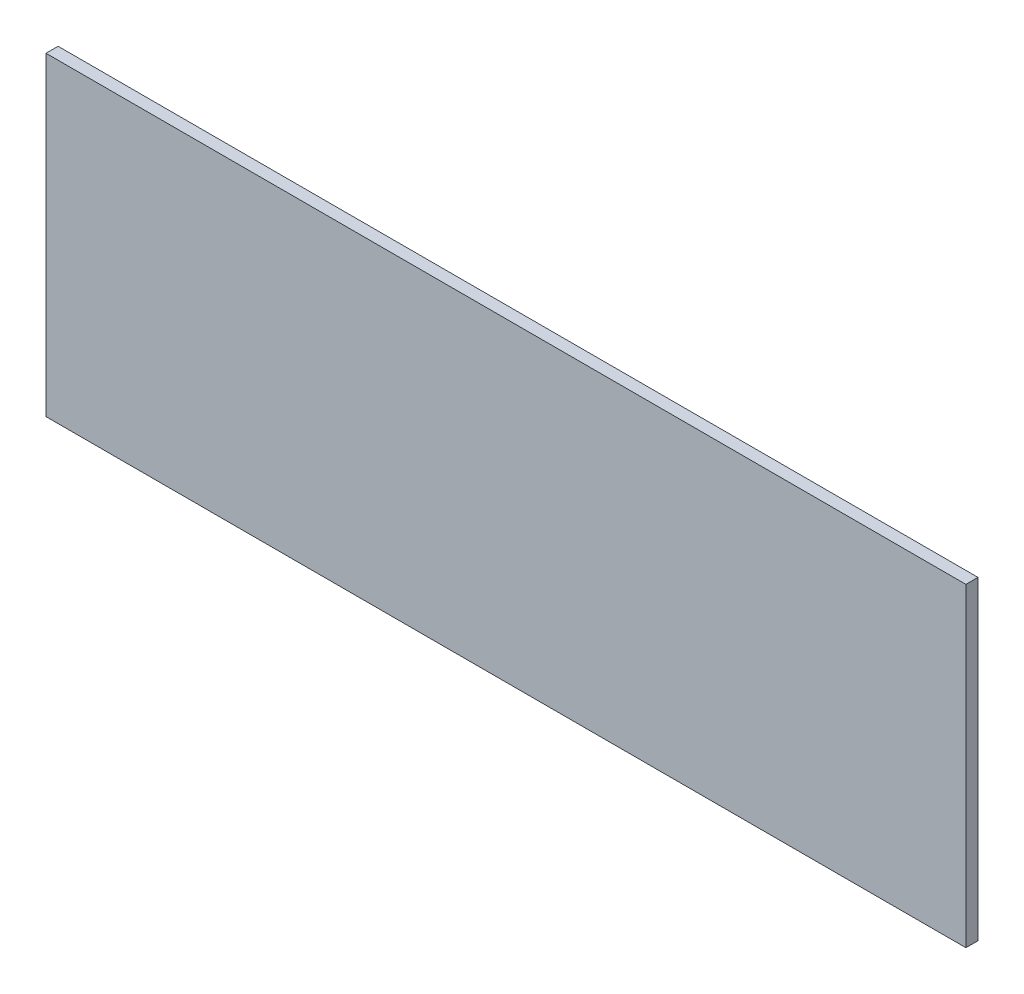
from build123d import *

# Parameters (mm, degrees)
SKETCH1_W           = 76
SKETCH1_H           = 26
BOSS_EXTRUDE1_DEPTH = 1


with BuildPart() as part:
    # Sketch1 → Boss-Extrude1 (new body)
    with BuildSketch(Plane.XY):
        with Locations((38, 13)):
            Rectangle(SKETCH1_W, SKETCH1_H)
    extrude(amount=BOSS_EXTRUDE1_DEPTH)


solid = part.part
